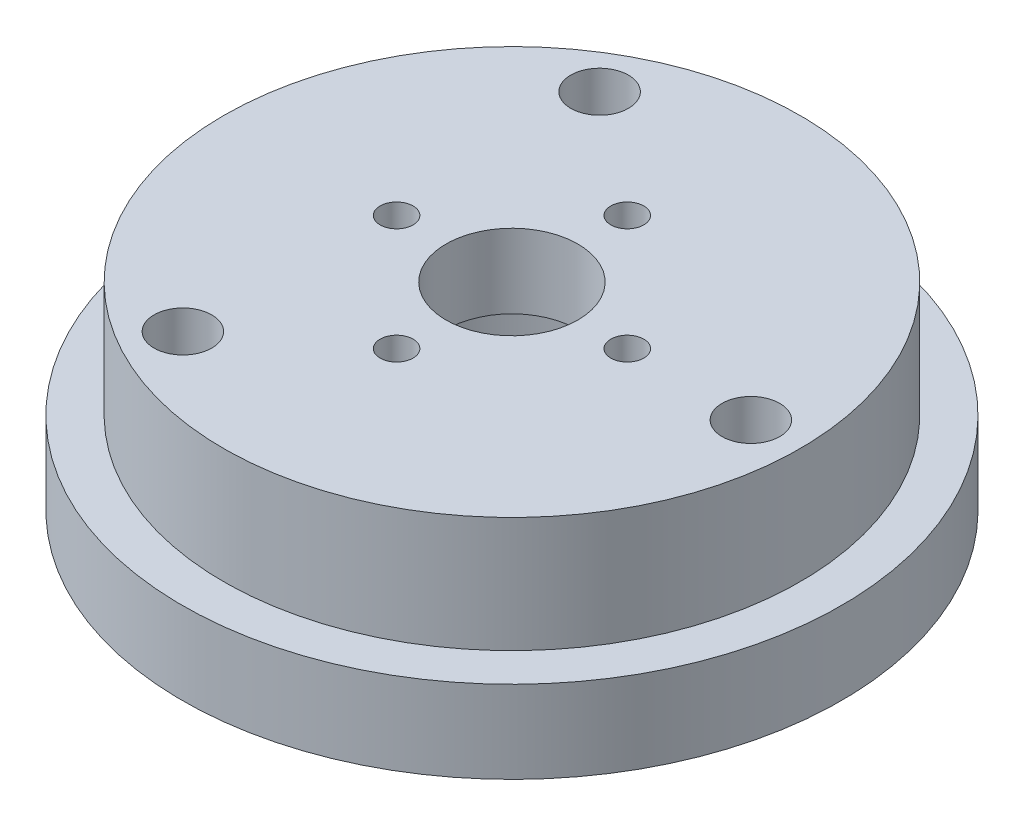
from build123d import *

# Parameters (mm, degrees)
SKETCH2_R          = 1.75
SKETCH2_R_2        = 4
SKETCH2_R_3        = 1
CUT_EXTRUDE5_DEPTH = 31.724582991
SKETCH2_7_R        = 10
CUT_EXTRUDE6_DEPTH = 7.5


with BuildPart() as part:
    # Sketch1 → Revolve2 (revolve)
    with BuildSketch(Plane.XY):
        Polygon((-20, 0), (0, 0), (0, 12), (-17.5, 12), (-17.5, 5), (-20, 5), align=None)
    revolve(axis=Axis((0, 12, 0), (0, -1, 0)))

    # Sketch2 → Cut-Extrude5 (cut, through all)
    with BuildSketch(Plane.XZ):
        with Locations((14.5, 0)):
            Circle(SKETCH2_R)
        with Locations((-7.340557342, -12.660927377)):
            Circle(SKETCH2_R)
        with Locations((-7.384963415, 12.584013803)):
            Circle(SKETCH2_R)
        Circle(SKETCH2_R_2)
        with Locations((7, 0)):
            Circle(SKETCH2_R_3)
        with Locations((0, -7)):
            Circle(SKETCH2_R_3)
        with Locations((-7, 0)):
            Circle(SKETCH2_R_3)
        with Locations((0, 7)):
            Circle(SKETCH2_R_3)
    extrude(amount=-CUT_EXTRUDE5_DEPTH, mode=Mode.SUBTRACT)

    # Sketch2<7> → Cut-Extrude6 (cut)
    with BuildSketch(Plane.XZ):
        Circle(SKETCH2_7_R)
    extrude(amount=-CUT_EXTRUDE6_DEPTH, mode=Mode.SUBTRACT)


solid = part.part
